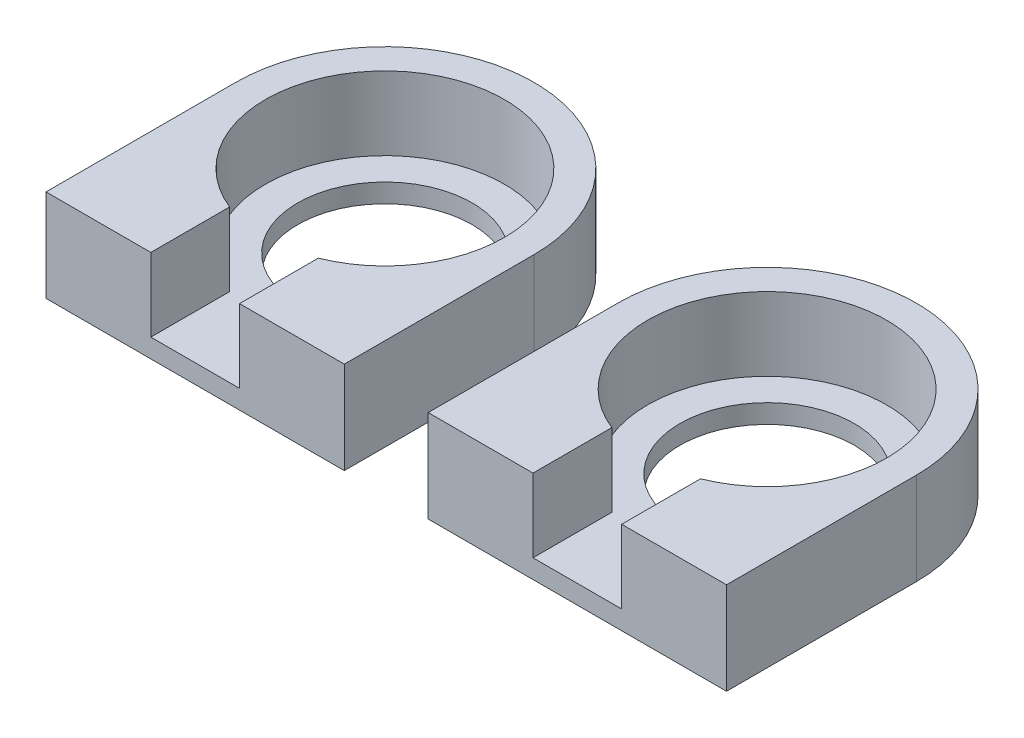
from build123d import *

# Parameters (mm, degrees)
SKETCH1_R                = 14.25
BOSS_EXTRUDE1_DEPTH      = 11
SKETCH4_R                = 14.25
BOSS_EXTRUDE2_DEPTH      = 2.25
SKETCH5_R                = 10.4
CUT_EXTRUDE1_DEPTH       = 2.25
SKETCH3_W                = 10.575
SKETCH3_H                = 12.228258218
CUT_EXTRUDE5_DEPTH       = 8.75
BOSS_EXTRUDE3_DEPTH      = 5
BOSS_EXTRUDE3_DEPTH_BACK = 45
SKETCH7_W                = 40.575
SKETCH7_H                = 1.5
SKETCH8_W                = 81.15
SKETCH8_H                = 1.5
CUT_EXTRUDE6_DEPTH       = 60


with BuildPart() as part:
    # Sketch1 → Boss-Extrude1 (new body)
    with BuildSketch(Plane(origin=(0, 0, 0), x_dir=(1, 0, 0), z_dir=(0, 1, 0))):
        with BuildLine():
            Line((-17.7875, -22.628070726), (17.7875, -22.628070726))
            Line((17.7875, -22.628070726), (17.7875, 0))
            ThreePointArc((17.7875, 0), (0, 17.7875), (-17.7875, 0))
            Line((-17.7875, 0), (-17.7875, -22.628070726))
        make_face()
        with Locations(Location((0, 0, 0), (0, 0, 270))):
            Circle(SKETCH1_R, mode=Mode.SUBTRACT)
    extrude(amount=BOSS_EXTRUDE1_DEPTH)

    # Sketch4 → Boss-Extrude2 (add)
    with BuildSketch(Plane.XZ):
        with Locations(Location((0, 0, 0), (0, 0, 270))):
            Circle(SKETCH4_R)
    extrude(amount=-BOSS_EXTRUDE2_DEPTH)

    # Sketch5 → Cut-Extrude1 (cut)
    with BuildSketch(Plane(origin=(0, 2.25, 0), x_dir=(1, 0, 0), z_dir=(0, 1, 0))):
        with Locations(Location((0, 0, 0), (0, 0, 270))):
            Circle(SKETCH5_R)
    extrude(amount=-CUT_EXTRUDE1_DEPTH, mode=Mode.SUBTRACT)

    # Sketch3 → Cut-Extrude5 (cut)
    with BuildSketch(Plane(origin=(0, 11, 0), x_dir=(1, 0, 0), z_dir=(0, 1, 0))):
        with Locations((0, -16.513941617)):
            Rectangle(SKETCH3_W, SKETCH3_H)
    extrude(amount=-CUT_EXTRUDE5_DEPTH, mode=Mode.SUBTRACT)

    # Sketch7 → Boss-Extrude3 (add, two sides: drawn at the far end of the back side and taken through both)
    with BuildSketch(Plane.XY.offset(22.628070726).offset(-BOSS_EXTRUDE3_DEPTH_BACK)):
        with Locations((2.5, -0.75)):
            Rectangle(SKETCH7_W, SKETCH7_H)
    extrude(amount=BOSS_EXTRUDE3_DEPTH + BOSS_EXTRUDE3_DEPTH_BACK)

    # Mirror5: part across plane


with BuildPart() as part_1:
    add(part.part)
    add(part.part.mirror(Plane(origin=(22.7875, 0, 0), x_dir=(0, 0, 1), z_dir=(1, 0, 0))))

    # Sketch8 → Cut-Extrude6 (cut)
    with BuildSketch(Plane.XY.offset(27.628070726)):
        with Locations((22.7875, -0.75)):
            Rectangle(SKETCH8_W, SKETCH8_H)
    extrude(amount=-CUT_EXTRUDE6_DEPTH, mode=Mode.SUBTRACT)


with BuildPart() as cut_extrude6_piece_1:
    # of the separate pieces the step leaves, piece 1, a body of its own (cut_extrude6_pieces)
    add(part_1.part.solids().sort_by_distance((27.7875, 0, 0))[0])


with BuildPart() as cut_extrude6_piece_2:
    # of the separate pieces the step leaves, piece 2, a body of its own (cut_extrude6_pieces)
    add(part_1.part.solids().sort_by_distance((-17.7875, 0, 22.628070726))[0])


solid = Compound([cut_extrude6_piece_1.part, cut_extrude6_piece_2.part])
